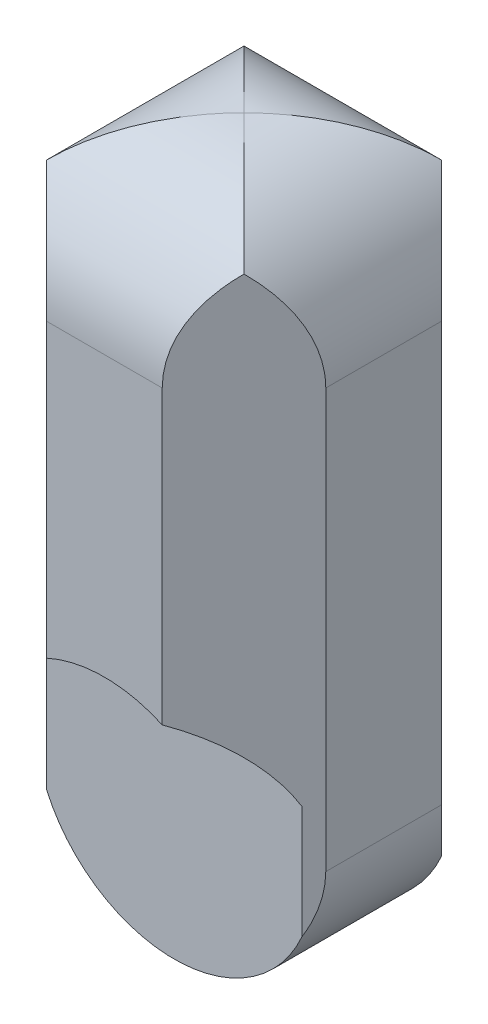
from build123d import *

# Parameters (mm, degrees)
EXTRUDE_1_DEPTH          = 40
CUT_EXTRUDE_1_DEPTH      = 42.569219382
CUT_EXTRUDE_1_DEPTH_BACK = 42.569219382
CUT_EXTRUDE_START        = -4
SKETCH_5_R               = 8
CUT_EXTRUDE_2_DEPTH      = 4
SKETCH_6_R               = 8
CUT_EXTRUDE_3_DEPTH      = 4
CUT_EXTRUDE_4_DEPTH      = 100
CUT_EXTRUDE_5_DEPTH      = 100


with BuildPart() as part:
    # 草图2 → 凸台-拉伸1 (new body)
    with BuildSketch(Plane(origin=(0, 0, 0), x_dir=(1, 0, 0), z_dir=(0, 1, 0))):
        Polygon((8, 3.313708499), (3.313708499, 8), (-3.313708499, 8), (-8, 3.313708499), (-8, -3.313708499), (-3.313708499, -8), (3.313708499, -8), (8, -3.313708499), align=None)
    extrude(amount=EXTRUDE_1_DEPTH)

    # 草图4 → 切除-拉伸1 (cut, two sides: drawn at the far end of the back side and taken through both)
    with BuildSketch(Plane.XY.offset(-CUT_EXTRUDE_1_DEPTH_BACK)):
        with BuildLine():
            Line((-8, 8), (-8, -3.683086278))
            Line((-8, -3.683086278), (8, -3.683086278))
            Line((8, -3.683086278), (8, 8))
            ThreePointArc((8, 8), (0, 0), (-8, 8))
        make_face()
    extrude(amount=CUT_EXTRUDE_1_DEPTH + CUT_EXTRUDE_1_DEPTH_BACK, mode=Mode.SUBTRACT)

    # 草图5 → 切除-拉伸2 (cut)
    with BuildSketch(Plane.XY.offset(8).offset(CUT_EXTRUDE_START)):
        with Locations((0, 8)):
            Circle(SKETCH_5_R)
    extrude(amount=CUT_EXTRUDE_2_DEPTH, mode=Mode.SUBTRACT)

    # 草图6 → 切除-拉伸3 (cut)
    with BuildSketch(Plane(origin=(0, 0, -8), x_dir=(-1, 0, 0), z_dir=(0, 0, -1))):
        with Locations((0, 8)):
            Circle(SKETCH_6_R)
    extrude(amount=-CUT_EXTRUDE_3_DEPTH, mode=Mode.SUBTRACT)

    # 草图7 → 切除-拉伸4 (cut)
    with BuildSketch(Plane(origin=(0, 0, -8), x_dir=(-1, 0, 0), z_dir=(0, 0, -1))):
        with BuildLine():
            Line((-8, 32), (-8, 48.980650176))
            Line((-8, 48.980650176), (8, 48.980650176))
            Line((8, 48.980650176), (8, 32))
            ThreePointArc((8, 32), (0, 40), (-8, 32))
        make_face()
    extrude(amount=-CUT_EXTRUDE_4_DEPTH, mode=Mode.SUBTRACT)

    # 草图8 → 切除-拉伸5 (cut)
    with BuildSketch(Plane.ZY.offset(8)):
        with BuildLine():
            Line((-8, 32), (-8, 42.16921849))
            Line((-8, 42.16921849), (8, 42.16921849))
            Line((8, 42.16921849), (8, 32))
            ThreePointArc((8, 32), (0, 40), (-8, 32))
        make_face()
    extrude(amount=-CUT_EXTRUDE_5_DEPTH, mode=Mode.SUBTRACT)


solid = part.part
